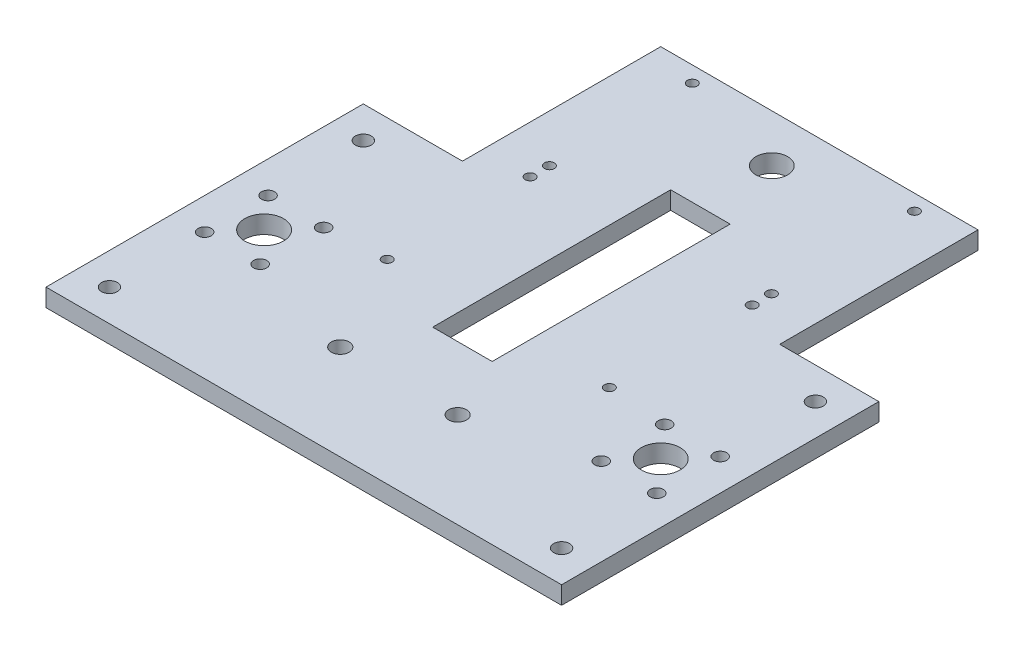
from build123d import *

# Parameters (mm, degrees)
SKETCH_2_W          = 130
SKETCH_2_H          = 80
SKETCH_2_R          = 4.9
SKETCH_2_R_2        = 1.65
EXTRUDE_1_DEPTH     = 4.5
SKETCH_3_R          = 2
CUT_EXTRUDE_1_DEPTH = 10
SKETCH_5_W          = 80
SKETCH_5_H          = 50
EXTRUDE_2_DEPTH     = 4.5
SKETCH_6_R          = 4
CUT_EXTRUDE_2_DEPTH = 10
SKETCH_7_R          = 2.25
CUT_EXTRUDE_3_DEPTH = 10
SKETCH_8_R          = 1.25
CUT_EXTRUDE_4_DEPTH = 10
SKETCH_9_W          = 15
SKETCH_9_H          = 60
CUT_EXTRUDE_5_DEPTH = 10
SKETCH_10_R         = 1.25
CUT_EXTRUDE_6_DEPTH = 10


with BuildPart() as part:
    # 草图2 → 凸台-拉伸1 (new body)
    with BuildSketch(Plane(origin=(0, 0, 0), x_dir=(1, 0, 0), z_dir=(0, 1, 0))):
        Rectangle(SKETCH_2_W, SKETCH_2_H)
        with Locations(Location((-50, 0, 0), (0, 0, 270))):
            Circle(SKETCH_2_R, mode=Mode.SUBTRACT)
        with Locations(Location((-57, 8, 0), (0, 0, 270))):
            Circle(SKETCH_2_R_2, mode=Mode.SUBTRACT)
        with Locations(Location((-57, -8, 0), (0, 0, 270))):
            Circle(SKETCH_2_R_2, mode=Mode.SUBTRACT)
        with Locations(Location((-43, 8, 0), (0, 0, 90))):
            Circle(SKETCH_2_R_2, mode=Mode.SUBTRACT)
        with Locations(Location((-43, -8, 0), (0, 0, 90))):
            Circle(SKETCH_2_R_2, mode=Mode.SUBTRACT)
        with Locations(Location((43, 8, 0), (0, 0, 270))):
            Circle(SKETCH_2_R_2, mode=Mode.SUBTRACT)
        with Locations(Location((43, -8, 0), (0, 0, 270))):
            Circle(SKETCH_2_R_2, mode=Mode.SUBTRACT)
        with Locations(Location((57, -8, 0), (0, 0, 90))):
            Circle(SKETCH_2_R_2, mode=Mode.SUBTRACT)
        with Locations(Location((50, 0, 0), (0, 0, 90))):
            Circle(SKETCH_2_R, mode=Mode.SUBTRACT)
        with Locations(Location((57, 8, 0), (0, 0, 90))):
            Circle(SKETCH_2_R_2, mode=Mode.SUBTRACT)
    extrude(amount=EXTRUDE_1_DEPTH)

    # 草图3 → 切除-拉伸1 (cut)
    with BuildSketch(Plane.XZ):
        with Locations(Location((-57, 32, 0), (0, 0, 270))):
            Circle(SKETCH_3_R)
        with Locations(Location((57, 32, 0), (0, 0, 90))):
            Circle(SKETCH_3_R)
        with Locations(Location((57, -32, 0), (0, 0, 270))):
            Circle(SKETCH_3_R)
        with Locations(Location((-57, -32, 0), (0, 0, 90))):
            Circle(SKETCH_3_R)
    extrude(amount=-CUT_EXTRUDE_1_DEPTH, mode=Mode.SUBTRACT)

    # 草图5 → 凸台-拉伸2 (add)
    with BuildSketch(Plane.XZ):
        with Locations((0, -65)):
            Rectangle(SKETCH_5_W, SKETCH_5_H)
    extrude(amount=-EXTRUDE_2_DEPTH)

    # 草图6 → 切除-拉伸2 (cut)
    with BuildSketch(Plane.XZ):
        with Locations(Location((0, -78, 0), (0, 0, 270))):
            Circle(SKETCH_6_R)
    extrude(amount=-CUT_EXTRUDE_2_DEPTH, mode=Mode.SUBTRACT)

    # 草图7 → 切除-拉伸3 (cut)
    with BuildSketch(Plane.XZ):
        with Locations(Location((-14.795139738, 16, 0), (0, 0, 270))):
            Circle(SKETCH_7_R)
        with Locations(Location((14.795139738, 16, 0), (0, 0, 270))):
            Circle(SKETCH_7_R)
    extrude(amount=-CUT_EXTRUDE_3_DEPTH, mode=Mode.SUBTRACT)

    # 草图8 → 切除-拉伸4 (cut)
    with BuildSketch(Plane.XZ):
        with Locations(Location((-28.039056388, -45.101338124, 0), (0, 0, 270))):
            Circle(SKETCH_8_R)
        with Locations(Location((27.968055626, -45.101338124, 0), (0, 0, 270))):
            Circle(SKETCH_8_R)
        with Locations(Location((27.917788926, -86.031350824, 0), (0, 0, 270))):
            Circle(SKETCH_8_R)
        with Locations(Location((-28.039056388, -85.995419912, 0), (0, 0, 270))):
            Circle(SKETCH_8_R)
    extrude(amount=-CUT_EXTRUDE_4_DEPTH, mode=Mode.SUBTRACT)

    # 草图9 → 切除-拉伸5 (cut)
    with BuildSketch(Plane.XZ):
        with Locations((0, -30)):
            Rectangle(SKETCH_9_W, SKETCH_9_H)
    extrude(amount=-CUT_EXTRUDE_5_DEPTH, mode=Mode.SUBTRACT)

    # 草图10 → 切除-拉伸6 (cut)
    with BuildSketch(Plane.XZ):
        with Locations(Location((27.968055626, -9.0699873, 0), (0, 0, 270))):
            Circle(SKETCH_10_R)
        with Locations(Location((-28.039056388, -9.0699873, 0), (0, 0, 270))):
            Circle(SKETCH_10_R)
        with Locations(Location((-28.039056388, -49.964069088, 0), (0, 0, 270))):
            Circle(SKETCH_10_R)
        with Locations(Location((27.917788926, -50, 0), (0, 0, 270))):
            Circle(SKETCH_10_R)
    extrude(amount=-CUT_EXTRUDE_6_DEPTH, mode=Mode.SUBTRACT)


solid = part.part
